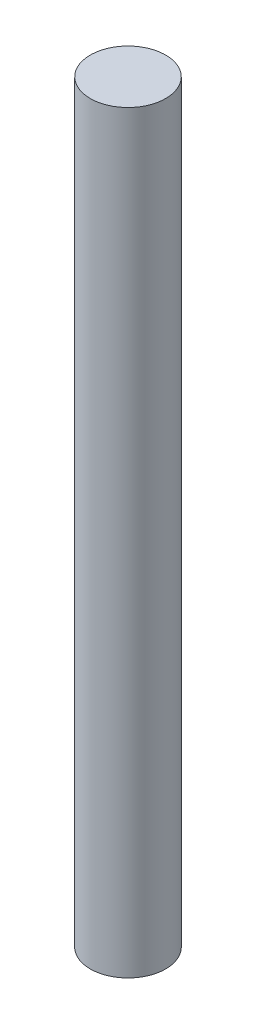
from build123d import *

# Parameters (mm, degrees)
SKETCH1_R           = 2.5
BOSS_EXTRUDE1_DEPTH = 50
SKETCH2_R           = 1.5
CUT_EXTRUDE1_DEPTH  = 9


with BuildPart() as part:
    # Sketch1 → Boss-Extrude1 (new body)
    with BuildSketch(Plane(origin=(0, 0, 0), x_dir=(1, 0, 0), z_dir=(0, 1, 0))):
        Circle(SKETCH1_R)
    extrude(amount=BOSS_EXTRUDE1_DEPTH)

    # Sketch2 → Cut-Extrude1 (cut)
    with BuildSketch(Plane(origin=(0, 0, 0), x_dir=(-1, 0, 0), z_dir=(0, -1, 0))):
        Circle(SKETCH2_R)
    extrude(amount=-CUT_EXTRUDE1_DEPTH, mode=Mode.SUBTRACT)


solid = part.part
